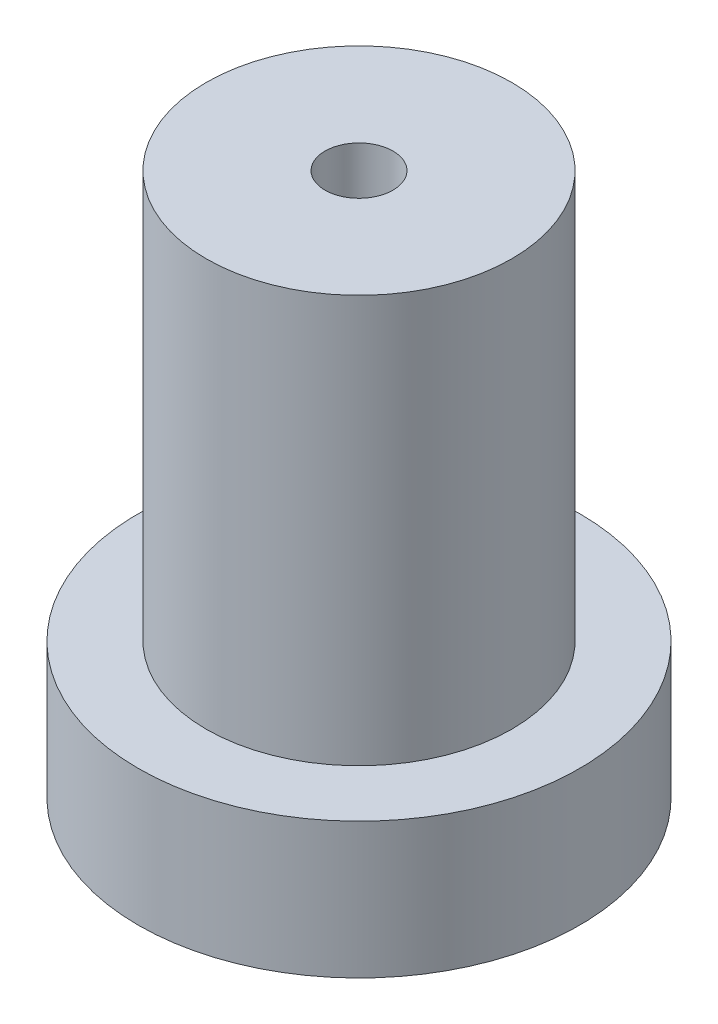
from build123d import *

# Parameters (mm, degrees)
SKETCH2_R          = 1
CUT_EXTRUDE1_DEPTH = 19.452642087


with BuildPart() as part:
    # Sketch1 → Revolve1 (revolve)
    with BuildSketch(Plane.XY, mode=Mode.PRIVATE) as revolve1_sk:
        Polygon((0, -2), (6.5, -2), (6.5, 2), (4.5, 2), (4.5, 14), (0, 14), align=None)
    revolve(revolve1_sk.sketch.rotate(Axis((0, 14, 0), (0, -1, 0)), 90), axis=Axis((0, 14, 0), (0, -1, 0)))

    # Sketch2 → Cut-Extrude1 (cut, through all)
    with BuildSketch(Plane.XZ.offset(2)):
        with Locations(Location((0, 0, 0), (0, 0, 270))):
            Circle(SKETCH2_R)
    extrude(amount=-CUT_EXTRUDE1_DEPTH, mode=Mode.SUBTRACT)


solid = part.part
